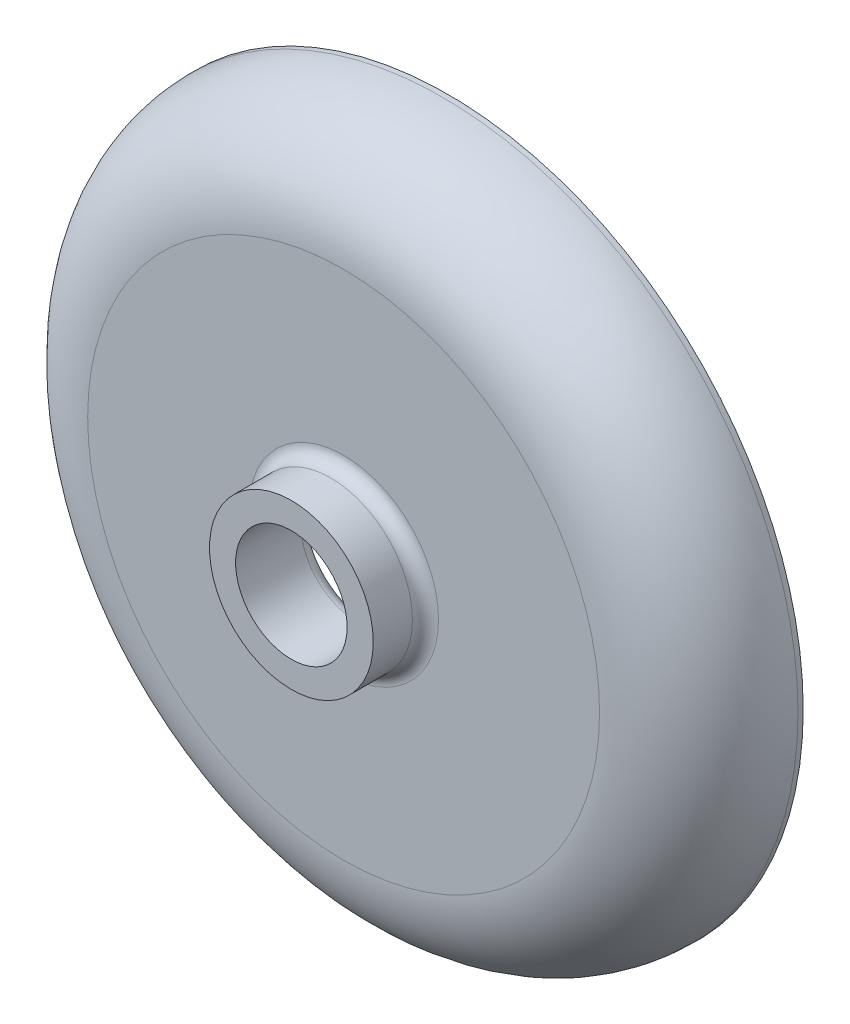
from build123d import *

# Parameters (mm, degrees)
SKETCH1_R                      = 13.6
DRIVE_SHAFT_PLATE_SHAPE_DEPTH  = 4
PLATE_MAIN_FILLET_R            = 3.8
SKETCH2_R                      = 3.135
PLATE_BOSS_DEPTH               = 2
PLATE_SHELL_T                  = -1
DRIVE_PLATE_HOLE_REACH         = 22.147
SKETCH3_R                      = 2.135
DRIVE_PLATE_SECONDARY_FILLET_R = 0.5


with BuildPart() as part:
    # Sketch1 → drive shaft plate shape (new body)
    with BuildSketch(Plane.XY):
        Circle(SKETCH1_R)
    extrude(amount=DRIVE_SHAFT_PLATE_SHAPE_DEPTH)

    # plate main fillet
    plate_main_fillet_edges = [part.edges().sort_by_distance(p)[0] for p in [
        (-13.6, 0, 4),
    ]]
    fillet(plate_main_fillet_edges, radius=PLATE_MAIN_FILLET_R)

    # Sketch2 → plate boss (add)
    with BuildSketch(Plane.XY.offset(4)):
        Circle(SKETCH2_R)
    extrude(amount=PLATE_BOSS_DEPTH)

    # plate shell
    plate_shell_openings = [part.faces().sort_by_distance(p)[0] for p in [
        (0, 0, 0),
    ]]
    offset(amount=PLATE_SHELL_T, openings=plate_shell_openings, kind=Kind.INTERSECTION)

    # Sketch3 → drive plate hole (cut, up to next)
    with BuildSketch(Plane.XY.offset(6), mode=Mode.PRIVATE) as drive_plate_hole_sk1:
        Circle(SKETCH3_R)
    drive_plate_hole_tool1 = extrude(drive_plate_hole_sk1.sketch, amount=-DRIVE_PLATE_HOLE_REACH, mode=Mode.PRIVATE) & part.part
    add(drive_plate_hole_tool1.solids().sort_by_distance((0, 0, 6))[0], mode=Mode.SUBTRACT)

    # drive plate secondary fillet
    drive_plate_secondary_fillet_edges = [part.edges().sort_by_distance(p)[0] for p in [
        (-2.135, 0, 3),
        (-3.135, 0, 4),
    ]]
    fillet(drive_plate_secondary_fillet_edges, radius=DRIVE_PLATE_SECONDARY_FILLET_R)


solid = part.part
